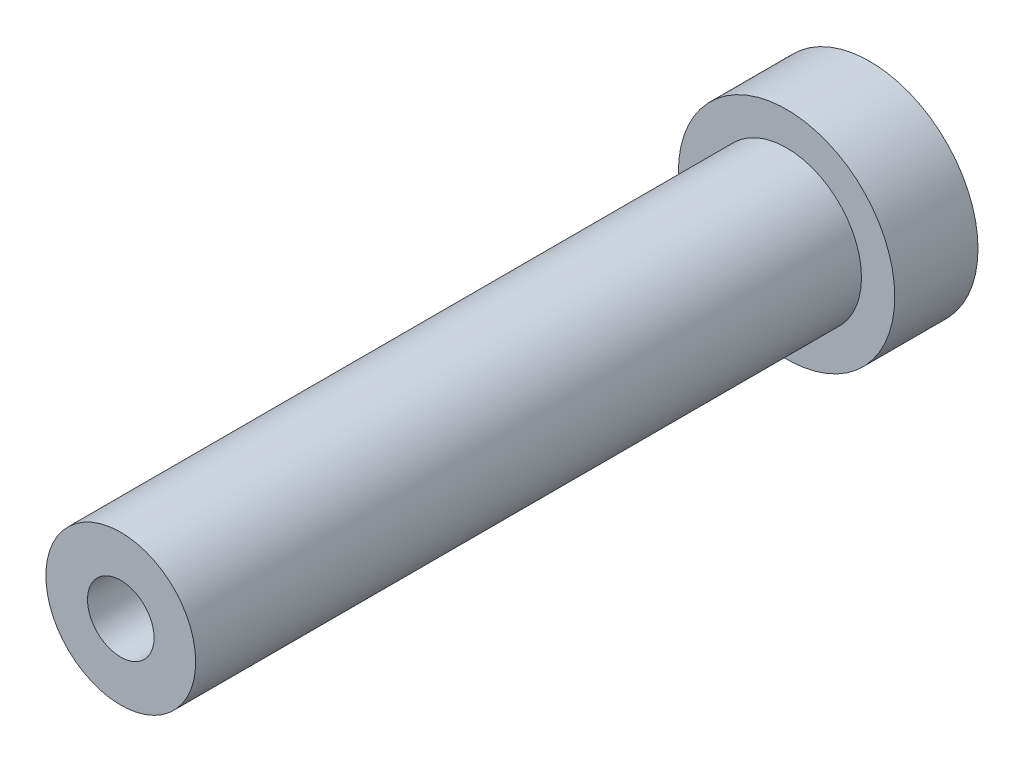
from build123d import *

# Parameters (mm, degrees)
SKETCH1_R           = 4.5
SKETCH1_R_2         = 2
BOSS_EXTRUDE1_DEPTH = 40
SKETCH2_R           = 6.5
BOSS_EXTRUDE2_DEPTH = 5


with BuildPart() as part:
    # Sketch1 → Boss-Extrude1 (new body)
    with BuildSketch(Plane.XY):
        Circle(SKETCH1_R)
        Circle(SKETCH1_R_2, mode=Mode.SUBTRACT)
    extrude(amount=BOSS_EXTRUDE1_DEPTH)

    # Sketch2 → Boss-Extrude2 (add)
    with BuildSketch(Plane(origin=(0, 0, 0), x_dir=(-1, 0, 0), z_dir=(0, 0, -1))):
        Circle(SKETCH2_R)
    extrude(amount=BOSS_EXTRUDE2_DEPTH)


solid = part.part
